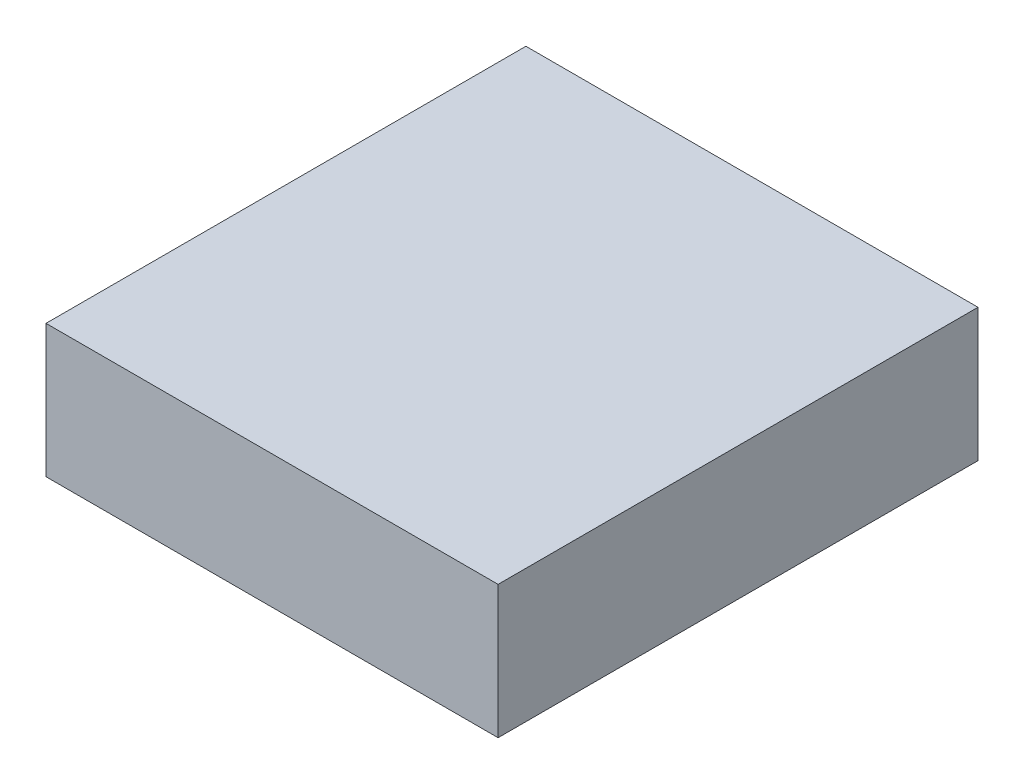
from build123d import *

# Parameters (mm, degrees)
SKETCH1_W           = 65
SKETCH1_H           = 19.1
BOSS_EXTRUDE1_DEPTH = 69


with BuildPart() as part:
    # Sketch1 → Boss-Extrude1 (new body)
    with BuildSketch(Plane.XY):
        Rectangle(SKETCH1_W, SKETCH1_H)
    extrude(amount=BOSS_EXTRUDE1_DEPTH)


solid = part.part
